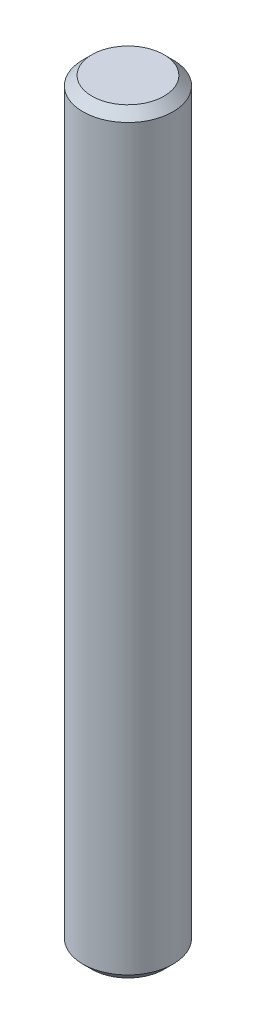
from build123d import *

# Parameters (mm, degrees)
SKETCH1_R           = 3.175
BOSS_EXTRUDE1_DEPTH = 53.34
CHAMFER1_SIZE       = 0.635


with BuildPart() as part:
    # Sketch1 → Boss-Extrude1 (new body)
    with BuildSketch(Plane(origin=(0, 0, 0), x_dir=(1, 0, 0), z_dir=(0, 1, 0))):
        with Locations(Location((0, 0, 0), (0, 0, 270))):
            Circle(SKETCH1_R)
    extrude(amount=BOSS_EXTRUDE1_DEPTH)

    # Chamfer1
    chamfer1_edges = [part.edges().sort_by_distance(p)[0] for p in [
        (0, 0, -3.175),
        (0, 53.34, -3.175),
    ]]
    chamfer(chamfer1_edges, length=CHAMFER1_SIZE)


solid = part.part
